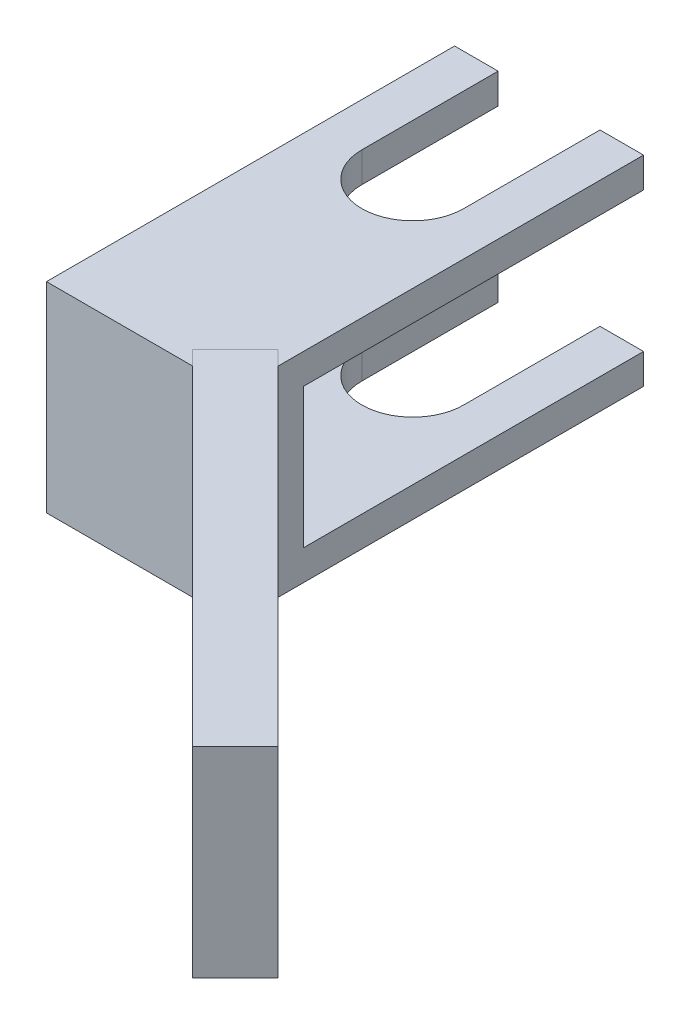
from build123d import *

# Parameters (mm, degrees)
SKETCH1_W                = 50
SKETCH1_H                = 100
BOSS_EXTRUDE1_DEPTH      = 8
CUT_EXTRUDE1_DEPTH       = 8
LPATTERN1_COUNT          = 2
LPATTERN1_PITCH          = 45
BOSS_EXTRUDE2_DEPTH      = 8
BOSS_EXTRUDE2_DEPTH_BACK = 10
SKETCH3_W                = 50
SKETCH3_H                = 53
BOSS_EXTRUDE3_DEPTH      = 8
BOSS_EXTRUDE3_DEPTH_BACK = 8
SKETCH4_W                = 128.695408592
SKETCH4_H                = 53


with BuildPart() as part:
    # Sketch1 → Boss-Extrude1 (new body)
    with BuildSketch(Plane(origin=(0, 0, 0), x_dir=(1, 0, 0), z_dir=(0, 1, 0))):
        with Locations((25, 50)):
            Rectangle(SKETCH1_W, SKETCH1_H)
    extrude(amount=BOSS_EXTRUDE1_DEPTH)

    # Sketch2 → Cut-Extrude1 (cut)
    with BuildSketch(Plane(origin=(0, 8, 0), x_dir=(1, 0, 0), z_dir=(0, 1, 0))):
        with BuildLine():
            Line((11.517328483, 63.940028427), (11.520448458, 100.001166238))
            ThreePointArc((11.520448458, 100.001166238), (25.001166238, 113.479551542), (38.479551542, 99.998833762))
            Line((38.479551542, 99.998833762), (38.476431567, 63.937695952))
            ThreePointArc((38.476431567, 63.937695952), (24.995713787, 50.459310648), (11.517328483, 63.940028427))
        make_face()
    extrude(amount=-CUT_EXTRUDE1_DEPTH, mode=Mode.SUBTRACT)


with BuildPart() as lpattern1_1:
    # LPattern1: pattern copy
    add(part.part.moved(Location(Vector(0, 1, 0) * (1 * LPATTERN1_PITCH))))


with BuildPart() as part_1:
    add(part.part)

    add(lpattern1_1.part)  # Boss-Extrude2 merges LPattern1_1
    # Sketch3 → Boss-Extrude2 (add, two sides: drawn at the far end of the back side and taken through both)
    with BuildSketch(Plane.XY.offset(-BOSS_EXTRUDE2_DEPTH_BACK)):
        with Locations((25, 26.5)):
            Rectangle(SKETCH3_W, SKETCH3_H)
    extrude(amount=BOSS_EXTRUDE2_DEPTH + BOSS_EXTRUDE2_DEPTH_BACK)


with BuildPart() as body_2:
    # Sketch4 → Boss-Extrude3 (new, two sides: drawn at the far end of the back side and taken through both)
    with BuildSketch(Plane(origin=(21, 0, -21), x_dir=(-0.7071067811865476, 0, -0.7071067811865475), z_dir=(0.7071067811865475, 0, -0.7071067811865476)).offset(-BOSS_EXTRUDE3_DEPTH_BACK)):
        with Locations((-92.048704228, 26.5)):
            Rectangle(SKETCH4_W, SKETCH4_H)
    extrude(amount=BOSS_EXTRUDE3_DEPTH + BOSS_EXTRUDE3_DEPTH_BACK)


solid = Compound([part_1.part, body_2.part])
